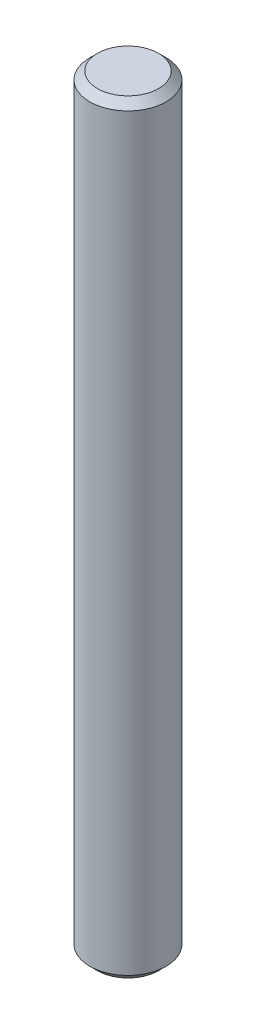
from build123d import *

# Parameters (mm, degrees)
SKETCH1_R           = 5
BOSS_EXTRUDE1_DEPTH = 100
CHAMFER1_SIZE       = 1


with BuildPart() as part:
    # Sketch1 → Boss-Extrude1 (new body)
    with BuildSketch(Plane(origin=(0, 0, 0), x_dir=(1, 0, 0), z_dir=(0, 1, 0))):
        with Locations(Location((0, 0, 0), (0, 0, 270))):
            Circle(SKETCH1_R)
    extrude(amount=BOSS_EXTRUDE1_DEPTH)

    # Chamfer1
    chamfer1_edges = [part.edges().sort_by_distance(p)[0] for p in [
        (0, 0, -5),
        (0, 100, -5),
    ]]
    chamfer(chamfer1_edges, length=CHAMFER1_SIZE)


solid = part.part
